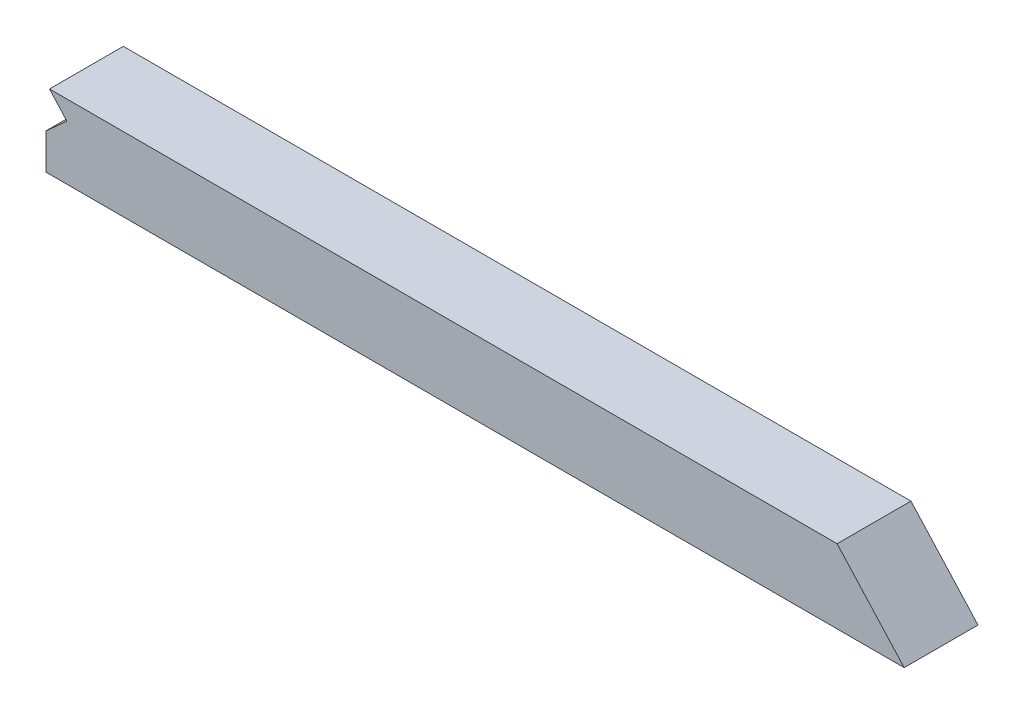
from build123d import *

# Parameters (mm, degrees)
SKETCH1_W               = 38.1
SKETCH1_H               = 38.1
BOSS_EXTRUDE1_DEPTH     = 442.976
CUT_EXTRUDE1_DEPTH      = 446.019380562
CUT_EXTRUDE2_DEPTH      = 446.019380562
CUT_EXTRUDE2_DEPTH_BACK = 446.019380562


with BuildPart() as part:
    # Sketch1 → Boss-Extrude1 (new body)
    with BuildSketch(Plane(origin=(0, 0, 0), x_dir=(0, 0, -1), z_dir=(1, 0, 0))):
        Rectangle(SKETCH1_W, SKETCH1_H)
    extrude(amount=BOSS_EXTRUDE1_DEPTH)

    # Sketch2 → Cut-Extrude1 (cut, through all)
    with BuildSketch(Plane.XY.offset(19.05)):
        Polygon((442.976, -19.05), (408.36839663, 19.05), (442.976, 19.05), align=None)
    extrude(amount=-CUT_EXTRUDE1_DEPTH, mode=Mode.SUBTRACT)

    # Sketch3 → Cut-Extrude2 (cut, two sides: drawn at the far end of the back side and taken through both)
    with BuildSketch(Plane.XY.offset(19.05).offset(-CUT_EXTRUDE2_DEPTH_BACK)):
        Polygon((0, 19.05), (0, -0.569448187), (1.811202923, 19.05), align=None)
        Polygon((0, -0.569448187), (1.811202923, 19.05), (10.756321618, 9.121476911), align=None)
    extrude(amount=CUT_EXTRUDE2_DEPTH + CUT_EXTRUDE2_DEPTH_BACK, mode=Mode.SUBTRACT)


solid = part.part
